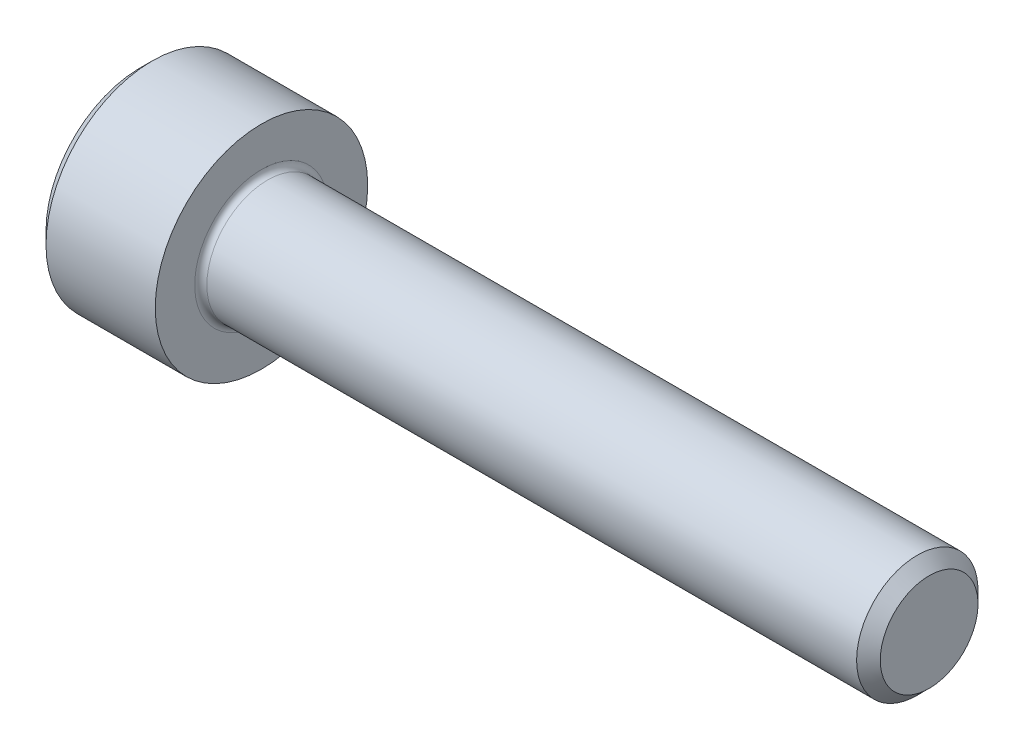
from build123d import *

# Parameters (mm, degrees)
FILLET1_R   = 0.2
HEX_2_DEPTH = 2


with BuildPart() as part:
    # BodySke → Base-Revolve (revolve)
    with BuildSketch(Plane.XY, mode=Mode.PRIVATE) as base_revolve_sk:
        Polygon((0, 0), (0, 3.1), (0.4, 3.5), (4, 3.5), (4, 2), (25.61, 2), (26, 1.61), (26, 0), align=None)
    revolve(base_revolve_sk.sketch.rotate(Axis((-31.75, 0, 0), (1, 0, 0)), 90), axis=Axis((-31.75, 0, 0), (1, 0, 0)))

    # Fillet1
    fillet1_edges = [part.edges().sort_by_distance(p)[0] for p in [
        (4, 0, -2),
    ]]
    fillet(fillet1_edges, radius=FILLET1_R)

    # Sketch2 → Hex-PreBroach (revolve, cut)
    with BuildSketch(Plane.XY, mode=Mode.PRIVATE) as hex_prebroach_sk:
        Polygon((0, 1.5355), (2, 1.5355), (2.886521338, 0), (0, 0), align=None)
    revolve(hex_prebroach_sk.sketch.rotate(Axis((0, 0, 0), (1, 0, 0)), 90), axis=Axis((0, 0, 0), (1, 0, 0)), mode=Mode.SUBTRACT)

    # Sketch3 → Hex 2 (cut)
    with BuildSketch(Plane(origin=(0, 0, 0), x_dir=(0, 0.500000000000001, 0.866025403784438), z_dir=(-1, 0, 0))):
        Polygon((0.886521338, 1.5355), (-0.886521338, 1.5355), (-1.773042677, 0), (-0.886521338, -1.5355), (0.886521338, -1.5355), (1.773042677, 0), align=None)
    extrude(amount=-HEX_2_DEPTH, mode=Mode.SUBTRACT)


solid = part.part
